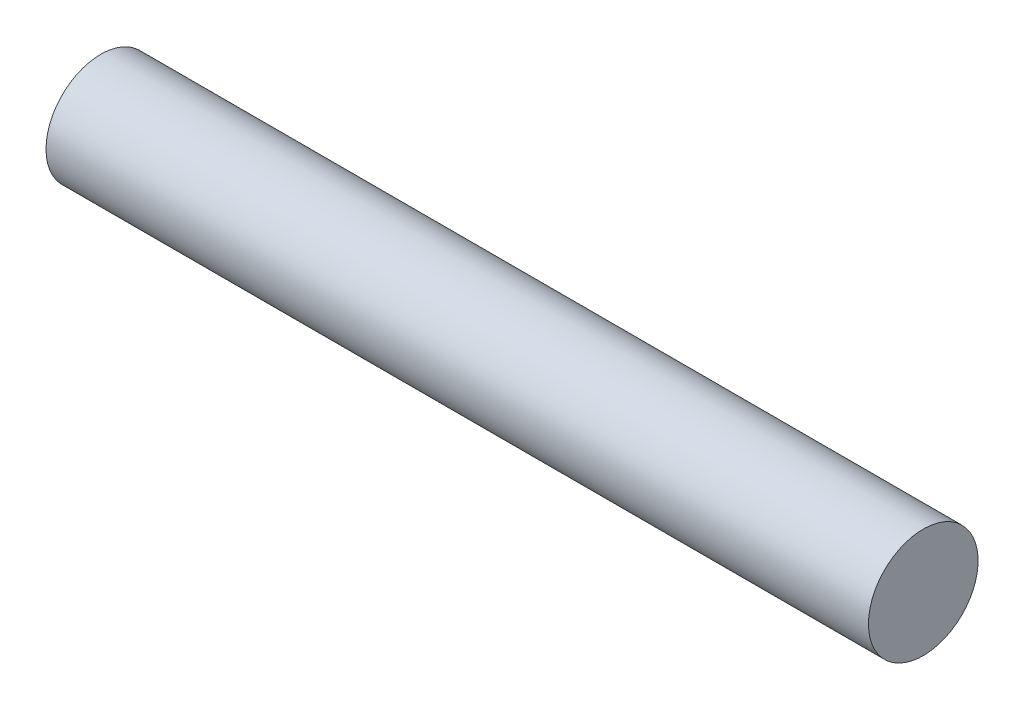
from build123d import *

# Parameters (mm, degrees)
SKIZZE1_W = 150
SKIZZE1_H = 10


with BuildPart() as part:
    # Skizze1 → Rotation1 (revolve)
    with BuildSketch(Plane(origin=(0, 0, 0), x_dir=(1, 0, 0), z_dir=(0, 1, 0)), mode=Mode.PRIVATE) as rotation1_sk:
        Rectangle(SKIZZE1_W, SKIZZE1_H)
    revolve(rotation1_sk.sketch.rotate(Axis((-75, 0, 5), (1, 0, 0)), 180), axis=Axis((-75, 0, 5), (1, 0, 0)))


solid = part.part
